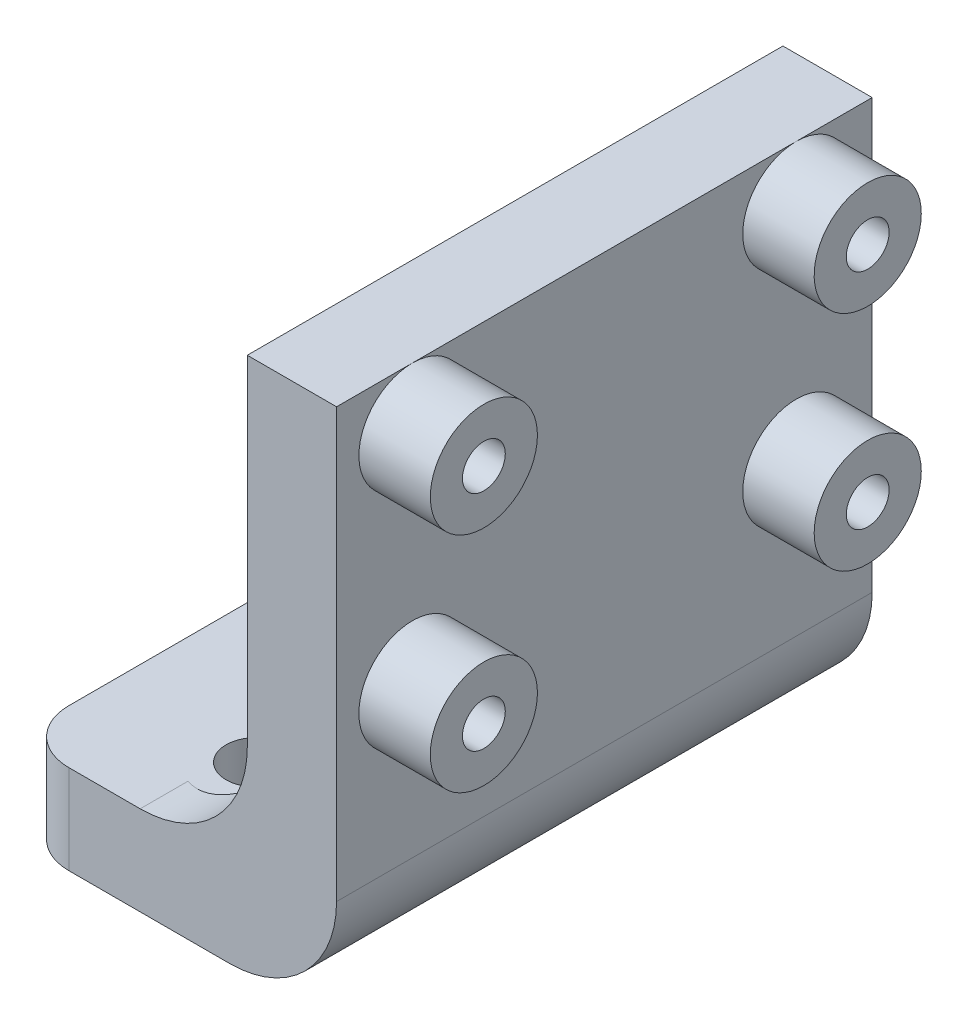
from build123d import *

# Parameters (mm, degrees)
SKETCH1_W           = 18
SKETCH1_H           = 30
BOSS_EXTRUDE1_DEPTH = 5
SKETCH2_W           = 30
SKETCH2_H           = 30
BOSS_EXTRUDE2_DEPTH = 5
SKETCH3_R           = 1.2
CUT_EXTRUDE1_DEPTH  = 5
FILLET1_R           = 6
BOSS_EXTRUDE3_START = 4
SKETCH4_R           = 3
SKETCH4_R_2         = 1.2
BOSS_EXTRUDE3_DEPTH = 4
SKETCH5_R           = 1.7
CUT_EXTRUDE2_DEPTH  = 24
SKETCH6_R           = 3
CUT_EXTRUDE3_DEPTH  = 24
FILLET2_R           = 3


with BuildPart() as part:
    # Sketch1 → Boss-Extrude1 (new body)
    with BuildSketch(Plane(origin=(0, 0, 0), x_dir=(1, 0, 0), z_dir=(0, 1, 0))):
        with Locations((9, 15)):
            Rectangle(SKETCH1_W, SKETCH1_H)
    extrude(amount=BOSS_EXTRUDE1_DEPTH)

    # Sketch2 → Boss-Extrude2 (add)
    with BuildSketch(Plane(origin=(18, 0, 0), x_dir=(0, 0, -1), z_dir=(1, 0, 0))):
        with Locations((15, 15)):
            Rectangle(SKETCH2_W, SKETCH2_H)
    extrude(amount=-BOSS_EXTRUDE2_DEPTH)

    # Sketch3 → Cut-Extrude1 (cut)
    with BuildSketch(Plane(origin=(18, 0, 0), x_dir=(0, 0, -1), z_dir=(1, 0, 0))):
        with Locations((4.25, 27)):
            Circle(SKETCH3_R)
        with Locations((25.75, 27)):
            Circle(SKETCH3_R)
        with Locations(Location((25.75, 14.5, 0), (0, 0, 180))):
            Circle(SKETCH3_R)
        with Locations(Location((4.25, 14.5, 0), (0, 0, 180))):
            Circle(SKETCH3_R)
    extrude(amount=-CUT_EXTRUDE1_DEPTH, mode=Mode.SUBTRACT)

    # Fillet1
    fillet1_edges = [part.edges().sort_by_distance(p)[0] for p in [
        (13, 5, -15),
        (18, 0, -15),
    ]]
    fillet(fillet1_edges, radius=FILLET1_R)

    # Sketch4 → Boss-Extrude3 (add)
    # profile 1 of 4: a face of its own
    with BuildSketch(Plane(origin=(18, 0, 0), x_dir=(0, 0, -1), z_dir=(1, 0, 0)).offset(BOSS_EXTRUDE3_START)):
        with Locations(Location((4.25, 27, 0), (0, 0, 90))):
            Circle(SKETCH4_R)
        with Locations((4.25, 27)):
            Circle(SKETCH4_R_2, mode=Mode.SUBTRACT)
    # profile 2 of 4: a face of its own
    with BuildSketch(Plane(origin=(18, 0, 0), x_dir=(0, 0, -1), z_dir=(1, 0, 0)).offset(BOSS_EXTRUDE3_START)):
        with Locations(Location((25.75, 27, 0), (0, 0, 90))):
            Circle(SKETCH4_R)
        with Locations((25.75, 27)):
            Circle(SKETCH4_R_2, mode=Mode.SUBTRACT)
    # profile 3 of 4: a face of its own
    with BuildSketch(Plane(origin=(18, 0, 0), x_dir=(0, 0, -1), z_dir=(1, 0, 0)).offset(BOSS_EXTRUDE3_START)):
        with Locations(Location((4.25, 14.5, 0), (0, 0, 180))):
            Circle(SKETCH4_R)
        with Locations((4.25, 14.5)):
            Circle(SKETCH4_R_2, mode=Mode.SUBTRACT)
    # profile 4 of 4: a face of its own
    with BuildSketch(Plane(origin=(18, 0, 0), x_dir=(0, 0, -1), z_dir=(1, 0, 0)).offset(BOSS_EXTRUDE3_START)):
        with Locations(Location((25.75, 14.5, 0), (0, 0, 180))):
            Circle(SKETCH4_R)
        with Locations((25.75, 14.5)):
            Circle(SKETCH4_R_2, mode=Mode.SUBTRACT)
    extrude(amount=-BOSS_EXTRUDE3_DEPTH)

    # Sketch5 → Cut-Extrude2 (cut)
    with BuildSketch(Plane.XZ):
        with Locations(Location((8, -5.510071499, 0), (0, 0, 270))):
            Circle(SKETCH5_R)
        with Locations(Location((8, -25.510071499, 0), (0, 0, 270))):
            Circle(SKETCH5_R)
    extrude(amount=-CUT_EXTRUDE2_DEPTH, mode=Mode.SUBTRACT)

    # Sketch6 → Cut-Extrude3 (cut)
    with BuildSketch(Plane(origin=(0, 5, 0), x_dir=(1, 0, 0), z_dir=(0, 1, 0))):
        with Locations((8, 25.510071499)):
            Circle(SKETCH6_R)
        with Locations((8, 5.510071499)):
            Circle(SKETCH6_R)
    extrude(amount=CUT_EXTRUDE3_DEPTH, mode=Mode.SUBTRACT)

    # Fillet2
    fillet2_edges = [part.edges().sort_by_distance(p)[0] for p in [
        (0, 2.5, -30),
        (0, 2.5, 0),
    ]]
    fillet(fillet2_edges, radius=FILLET2_R)


solid = part.part
